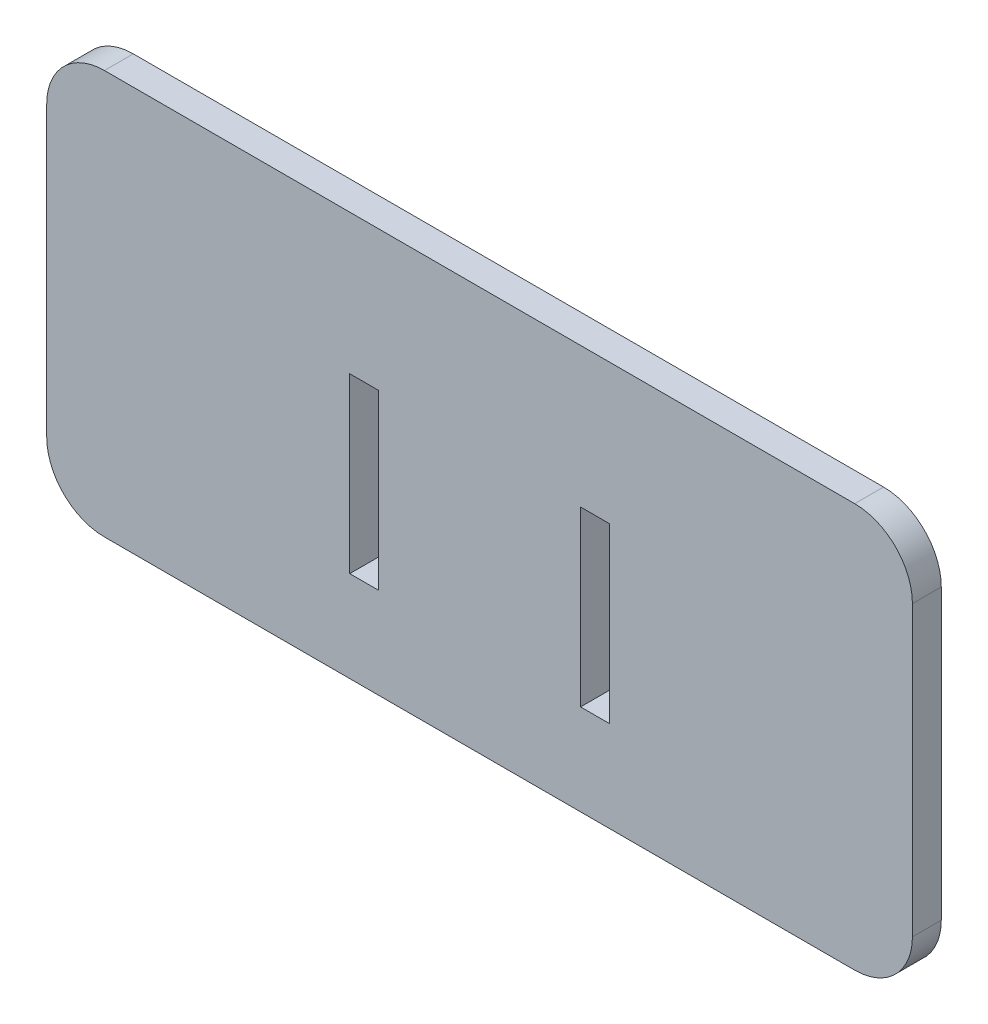
from build123d import *

# Parameters (mm, degrees)
BOSS_EXTRUDE1_DEPTH = 10
SKETCH2_W           = 10
SKETCH2_H           = 60
CUT_EXTRUDE1_DEPTH  = 10


with BuildPart() as part:
    # Sketch1 → Boss-Extrude1 (new body)
    with BuildSketch(Plane.XY):
        with BuildLine():
            Line((80, 40), (-180, 40))
            ThreePointArc((-180, 40), (-194.142135624, 34.142135624), (-200, 20))
            Line((-200, 20), (-200, -80))
            ThreePointArc((-200, -80), (-194.142135624, -94.142135624), (-180, -100))
            Line((-180, -100), (80, -100))
            ThreePointArc((80, -100), (94.142135624, -94.142135624), (100, -80))
            Line((100, -80), (100, 20))
            ThreePointArc((100, 20), (94.142135624, 34.142135624), (80, 40))
        make_face()
    extrude(amount=BOSS_EXTRUDE1_DEPTH)

    # Sketch2 → Cut-Extrude1 (cut)
    with BuildSketch(Plane.XY.offset(10)):
        with Locations((-90, -38.5)):
            Rectangle(SKETCH2_W, SKETCH2_H)
        with Locations((-10, -38.5)):
            Rectangle(SKETCH2_W, SKETCH2_H)
    extrude(amount=-CUT_EXTRUDE1_DEPTH, mode=Mode.SUBTRACT)


solid = part.part
